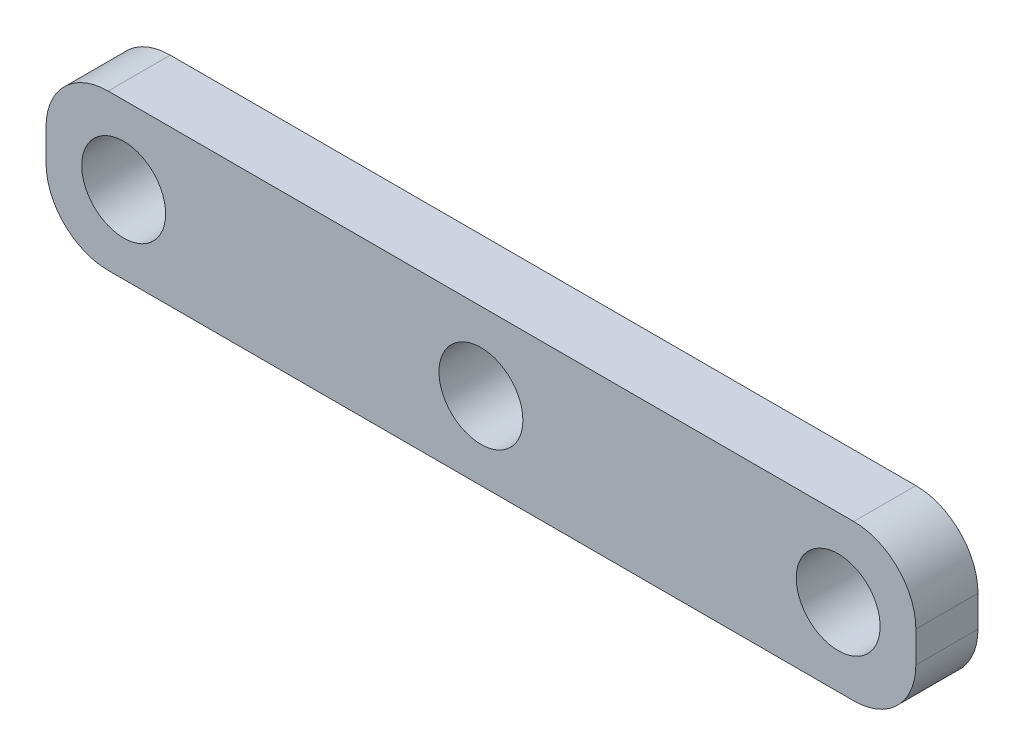
from build123d import *

# Parameters (mm, degrees)
SKETCH_1_W      = 28
SKETCH_1_H      = 5
SKETCH_1_R      = 1.35
EXTRUDE_1_DEPTH = 2
FILLET_1_R      = 2


with BuildPart() as part:
    # 草图1 → 凸台-拉伸1 (new body)
    with BuildSketch(Plane.XY):
        Rectangle(SKETCH_1_W, SKETCH_1_H)
        with Locations((-11.5, 0)):
            Circle(SKETCH_1_R, mode=Mode.SUBTRACT)
        with Locations(Location((11.5, 0, 0), (0, 0, 180))):
            Circle(SKETCH_1_R, mode=Mode.SUBTRACT)
        Circle(SKETCH_1_R, mode=Mode.SUBTRACT)
    extrude(amount=EXTRUDE_1_DEPTH)

    # 圆角1
    fillet_1_edges = [part.edges().sort_by_distance(p)[0] for p in [
        (14, -2.5, 1),
        (-14, -2.5, 1),
        (-14, 2.5, 1),
        (14, 2.5, 1),
    ]]
    fillet(fillet_1_edges, radius=FILLET_1_R)


solid = part.part
